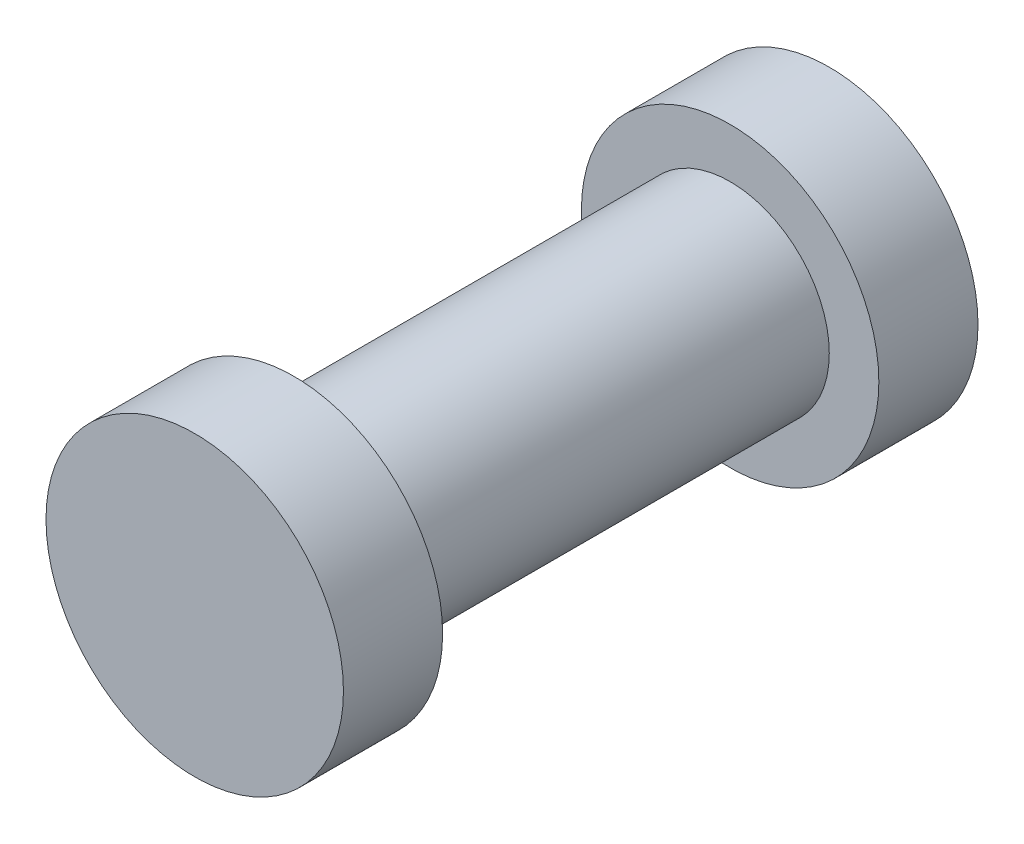
from build123d import *

# Parameters (mm, degrees)
SKETCH1_R           = 5
BOSS_EXTRUDE1_DEPTH = 32
SKETCH1_4_R         = 7.5
SKETCH1_4_R_2       = 5
BOSS_EXTRUDE2_DEPTH = 5
BOSS_EXTRUDE3_START = 27
SKETCH1_5_R         = 7.5
SKETCH1_5_R_2       = 5
BOSS_EXTRUDE3_DEPTH = 5


with BuildPart() as part:
    # Sketch1 → Boss-Extrude1 (new body)
    with BuildSketch(Plane.XY):
        Circle(SKETCH1_R)
    extrude(amount=BOSS_EXTRUDE1_DEPTH)

    # Sketch1<4> → Boss-Extrude2 (add)
    with BuildSketch(Plane.XY):
        Circle(SKETCH1_4_R)
        Circle(SKETCH1_4_R_2, mode=Mode.SUBTRACT)
    extrude(amount=BOSS_EXTRUDE2_DEPTH)

    # Sketch1<5> → Boss-Extrude3 (add)
    with BuildSketch(Plane.XY.offset(BOSS_EXTRUDE3_START)):
        Circle(SKETCH1_5_R)
        Circle(SKETCH1_5_R_2, mode=Mode.SUBTRACT)
    extrude(amount=BOSS_EXTRUDE3_DEPTH)


solid = part.part
